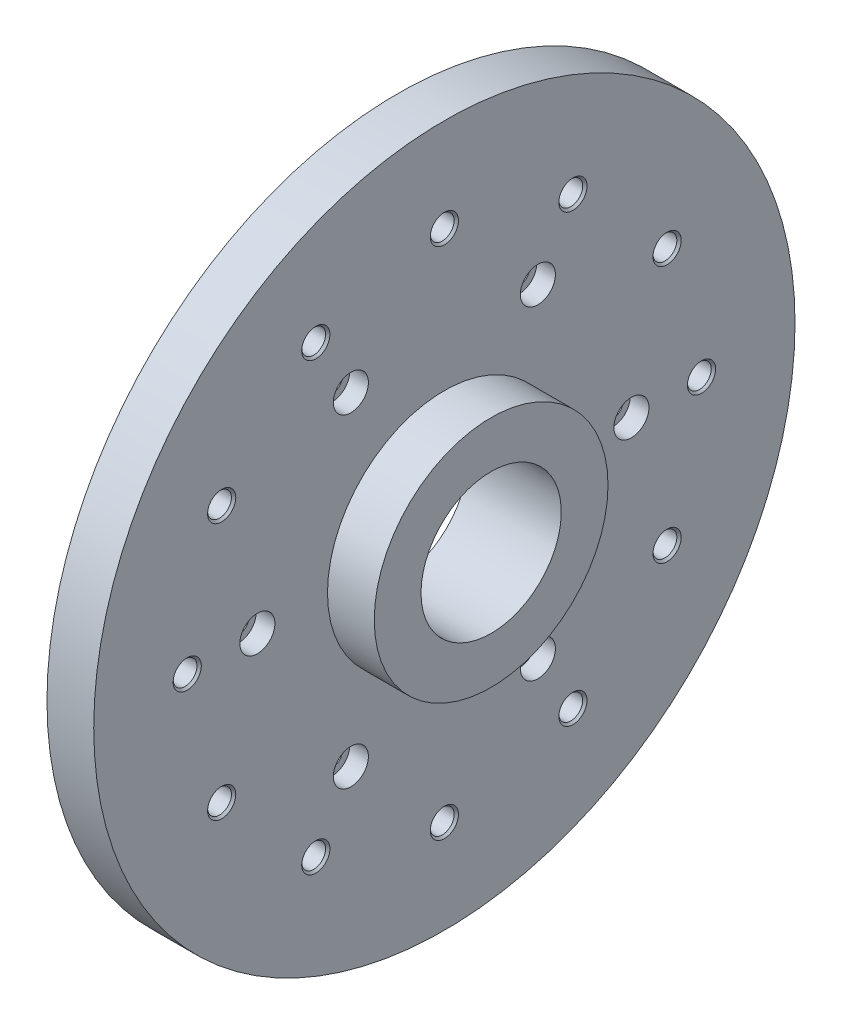
from build123d import *

# Parameters (mm, degrees)
M8_SHCS_IN_HAV_A1_D               = 9
M8_SHCS_IN_HAV_A1_CBORE_D         = 15
M8_SHCS_IN_HAV_A1_CBORE_DEPTH     = 8
M12X1_75_DI_LI_DELIK1_D           = 10.2
M12X1_75_DI_LI_DELIK1_CSINK_D     = 12.05
M12X1_75_DI_LI_DELIK1_CSINK_ANGLE = 90


with BuildPart() as part:
    # Çizim1 → Döndür1 (revolve)
    with BuildSketch(Plane.XY, mode=Mode.PRIVATE) as d_nd_r1_sk:
        Polygon((-47.583548513, 30), (-7.583548513, 30), (-7.583548513, 50), (-27.583548513, 50), (-27.583548513, 150), (-47.583548513, 150), align=None)
    revolve(d_nd_r1_sk.sketch.rotate(Axis((-58.347943389, 0, 0), (1, 0, 0)), 90), axis=Axis((-58.347943389, 0, 0), (1, 0, 0)))

    # M8 SHCS İçin Havşa1 (through all)
    with Locations(Plane(origin=(-27.583548513, 0, 0), x_dir=(0, 0, -1), z_dir=(1, 0, 0))):
        with Locations((80, 0), (401.288725226, 148.981360789), (40, -69.282032303), (-40, -69.282032303), (-80, 0), (-40, 69.282032303), (40, 69.282032303), (0, 0)):
            CounterBoreHole(M8_SHCS_IN_HAV_A1_D / 2, M8_SHCS_IN_HAV_A1_CBORE_D / 2, M8_SHCS_IN_HAV_A1_CBORE_DEPTH)

    # M12x1.75 Dişli Delik1 (through all)
    with Locations(Plane(origin=(-27.583548513, 0, 0), x_dir=(0, 0, -1), z_dir=(1, 0, 0))):
        with Locations((110, 0), (95.262794416, -55), (55, -95.262794416), (0, -110), (-55, -95.262794416), (-95.262794416, -55), (-110, 0), (-95.262794416, 55), (-55, 95.262794416), (0, 110), (55, 95.262794416), (95.262794416, 55), (0, 0)):
            CounterSinkHole(M12X1_75_DI_LI_DELIK1_D / 2, M12X1_75_DI_LI_DELIK1_CSINK_D / 2, counter_sink_angle=M12X1_75_DI_LI_DELIK1_CSINK_ANGLE)


solid = part.part
